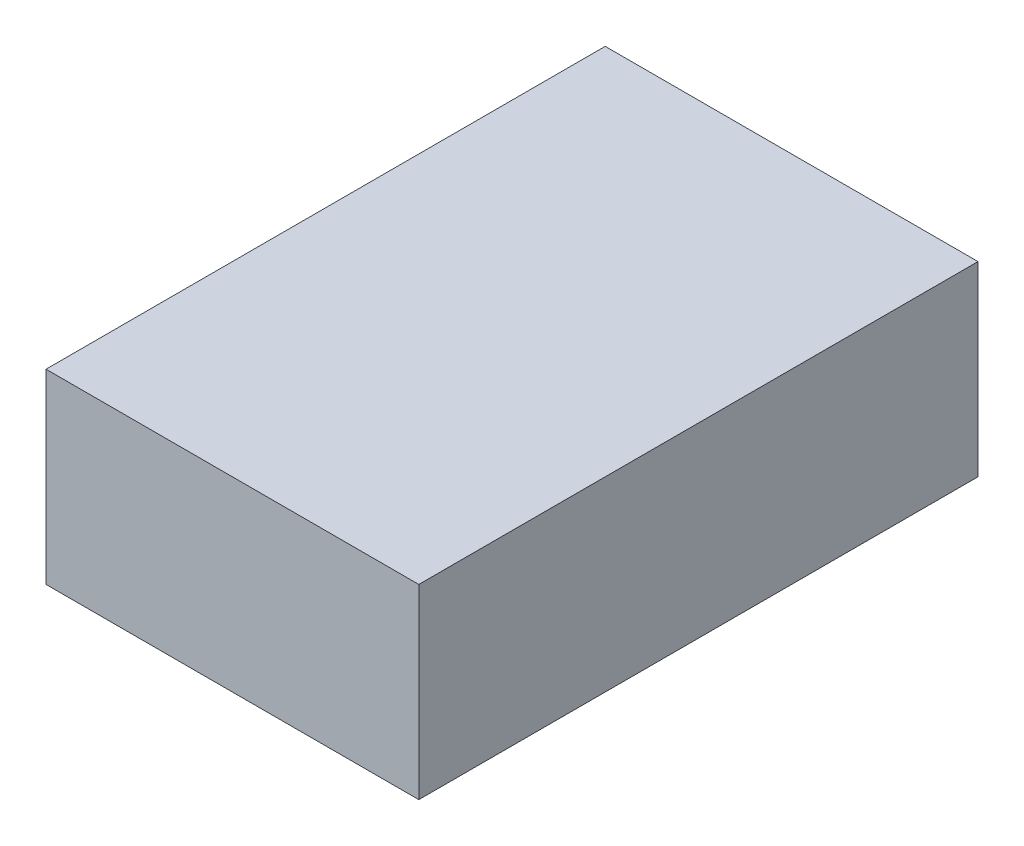
from build123d import *

# Parameters (mm, degrees)
SKETCH1_W           = 50.8
SKETCH1_H           = 76.2
BOSS_EXTRUDE1_DEPTH = 25.4


with BuildPart() as part:
    # Sketch1 → Boss-Extrude1 (new body)
    with BuildSketch(Plane(origin=(0, 0, 0), x_dir=(1, 0, 0), z_dir=(0, 1, 0))):
        with Locations((12.904137505, -12.288663968)):
            Rectangle(SKETCH1_W, SKETCH1_H)
    extrude(amount=BOSS_EXTRUDE1_DEPTH)


solid = part.part
